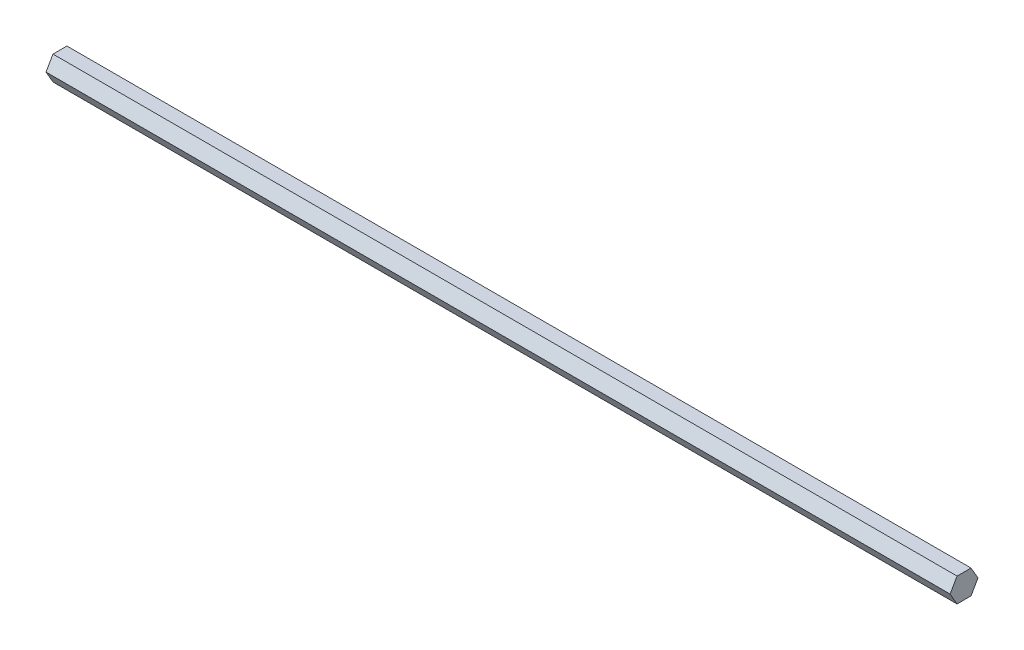
from build123d import *

# Parameters (mm, degrees)
SALIENTE_EXTRUIR1_DEPTH = 475


with BuildPart() as part:
    # Croquis1 → Saliente-Extruir1 (new body)
    with BuildSketch(Plane(origin=(0, 0, 0), x_dir=(0, 0, -1), z_dir=(1, 0, 0))):
        Polygon((7.332348419, 0), (3.666174209, 6.35), (-3.666174209, 6.35), (-7.332348419, 0), (-3.666174209, -6.35), (3.666174209, -6.35), align=None)
    extrude(amount=SALIENTE_EXTRUIR1_DEPTH)


solid = part.part
